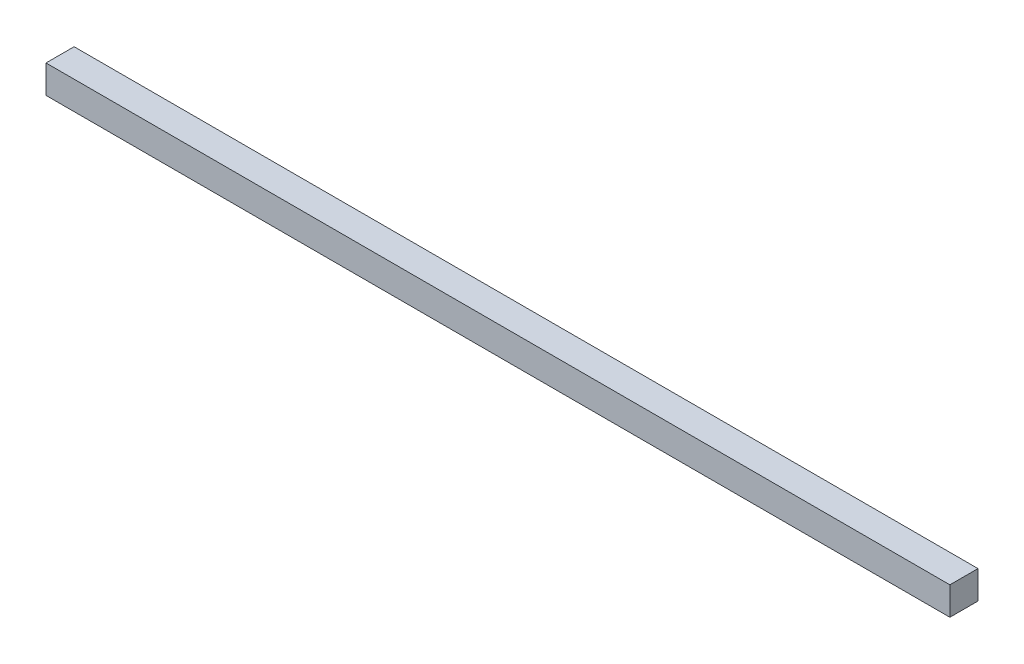
from build123d import *

# Parameters (mm, degrees)
SKETCH1_W                        = 612.2797
SKETCH1_H                        = 19.05
BOSS_EXTRUDE1_DEPTH              = 19.05
F_1_8_0_125_DIAMETER_HOLE1_D     = 3.175
F_1_8_0_125_DIAMETER_HOLE1_DEPTH = 11.1125
F_1_8_0_125_DIAMETER_HOLE1_TIP   = 0.953866233


with BuildPart() as part:
    # Sketch1 → Boss-Extrude1 (new body)
    with BuildSketch(Plane(origin=(0, 0, 0), x_dir=(1, 0, 0), z_dir=(0, 1, 0))):
        Rectangle(SKETCH1_W, SKETCH1_H)
    extrude(amount=BOSS_EXTRUDE1_DEPTH)

    # 1/8 (0.125) Diameter Hole1
    with Locations(Plane(origin=(0, 0, 0), x_dir=(-1, 0, 0), z_dir=(0, -1, 0))):
        with Locations((254, 0), (152.4, 0), (50.8, 0), (-50.8, 0), (-152.4, 0), (-254, 0)):
            Hole(F_1_8_0_125_DIAMETER_HOLE1_D / 2, depth=F_1_8_0_125_DIAMETER_HOLE1_DEPTH)
            with Locations((0, 0, -(F_1_8_0_125_DIAMETER_HOLE1_DEPTH + F_1_8_0_125_DIAMETER_HOLE1_TIP / 2))):  # 118° drill point
                Cone(0, F_1_8_0_125_DIAMETER_HOLE1_D / 2, F_1_8_0_125_DIAMETER_HOLE1_TIP, mode=Mode.SUBTRACT)


solid = part.part
